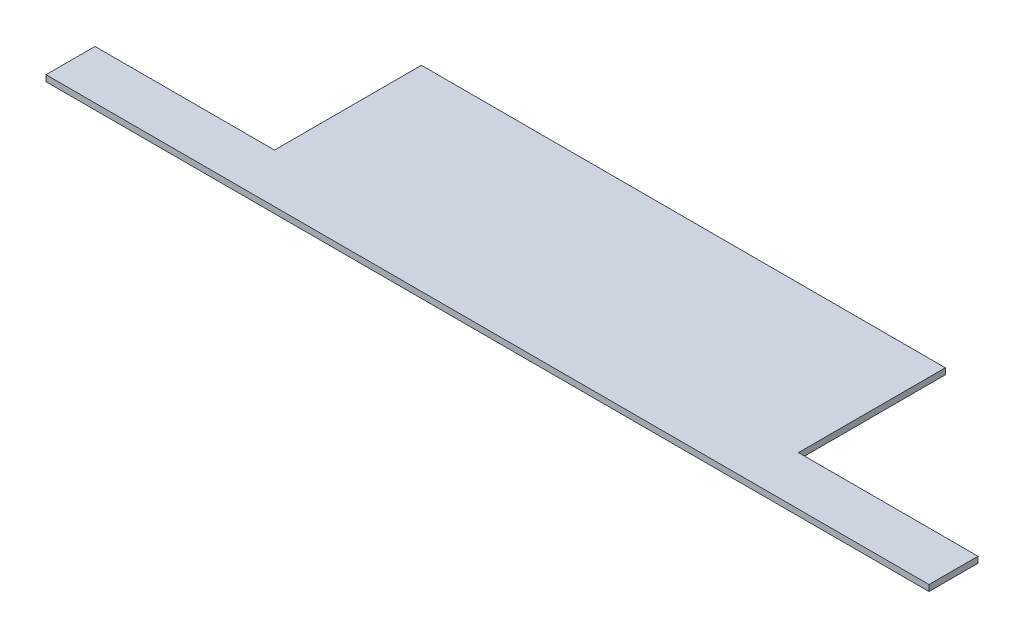
from build123d import *

# Parameters (mm, degrees)
BOSS_EXTRUDE1_DEPTH = 4.7625


with BuildPart() as part:
    # Sketch1 → Boss-Extrude1 (new body)
    with BuildSketch(Plane(origin=(0, 0, 0), x_dir=(1, 0, 0), z_dir=(0, 1, 0))):
        Polygon((342.899703373, -38.403428205), (-344.211504346, -38.403428205), (-344.211504346, -0.303428205), (-204.511504346, -0.303428205), (-204.511504346, 113.996571795), (203.199703373, 113.996571795), (203.199703373, -0.303428205), (342.899703373, -0.303428205), align=None)
    extrude(amount=BOSS_EXTRUDE1_DEPTH)


solid = part.part
